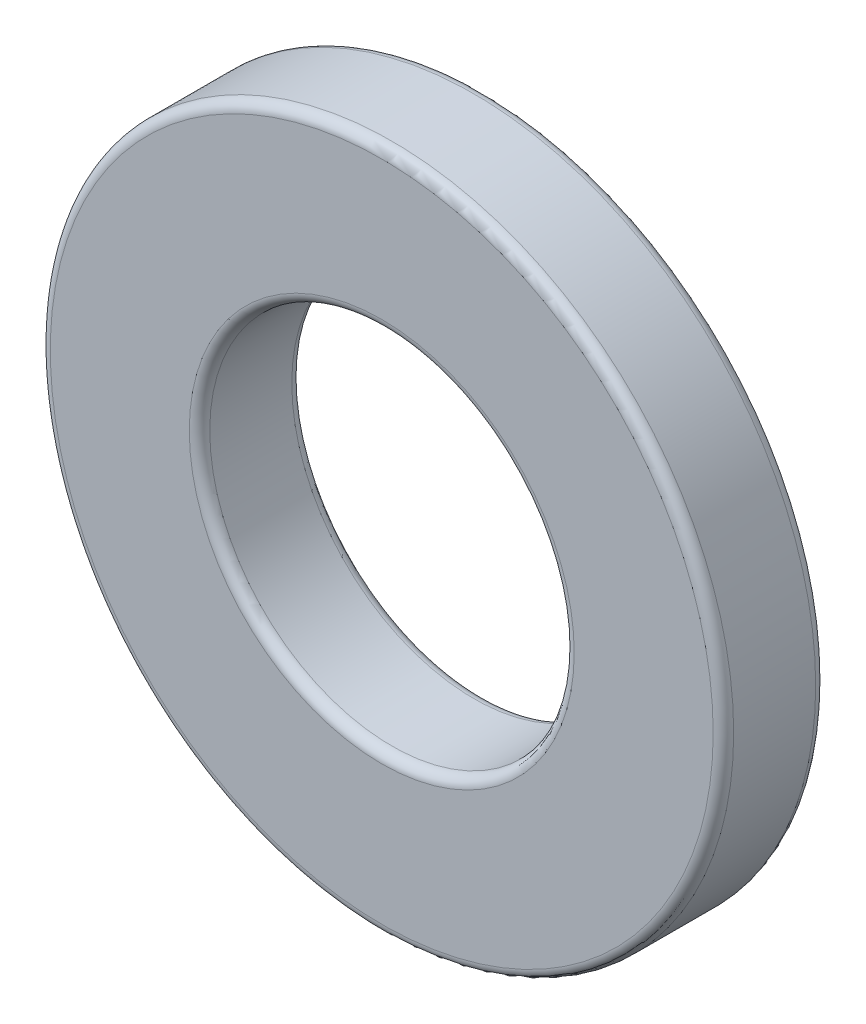
from build123d import *

# Parameters (mm, degrees)
BOSS_EXTRUDE1_DEPTH      = 0.9
BOSS_EXTRUDE1_DEPTH_BACK = 0.9
SKETCH3_R                = 6
SKETCH3_R_2              = 3.2
FILLET1_R                = 0.18


with BuildPart() as part:
    # Sketch3 → Boss-Extrude1 (new, two sides: drawn at the far end of the back side and taken through both)
    with BuildSketch(Plane.XY.offset(-BOSS_EXTRUDE1_DEPTH_BACK)):
        Circle(SKETCH3_R)
        Circle(SKETCH3_R_2, mode=Mode.SUBTRACT)
    extrude(amount=BOSS_EXTRUDE1_DEPTH + BOSS_EXTRUDE1_DEPTH_BACK)

    # Fillet1
    fillet1_edges = [part.edges().sort_by_distance(p)[0] for p in [
        (-6, 0, -0.9),
        (-3.2, 0, -0.9),
        (-6, 0, 0.9),
        (-3.2, 0, 0.9),
    ]]
    fillet(fillet1_edges, radius=FILLET1_R)


solid = part.part
